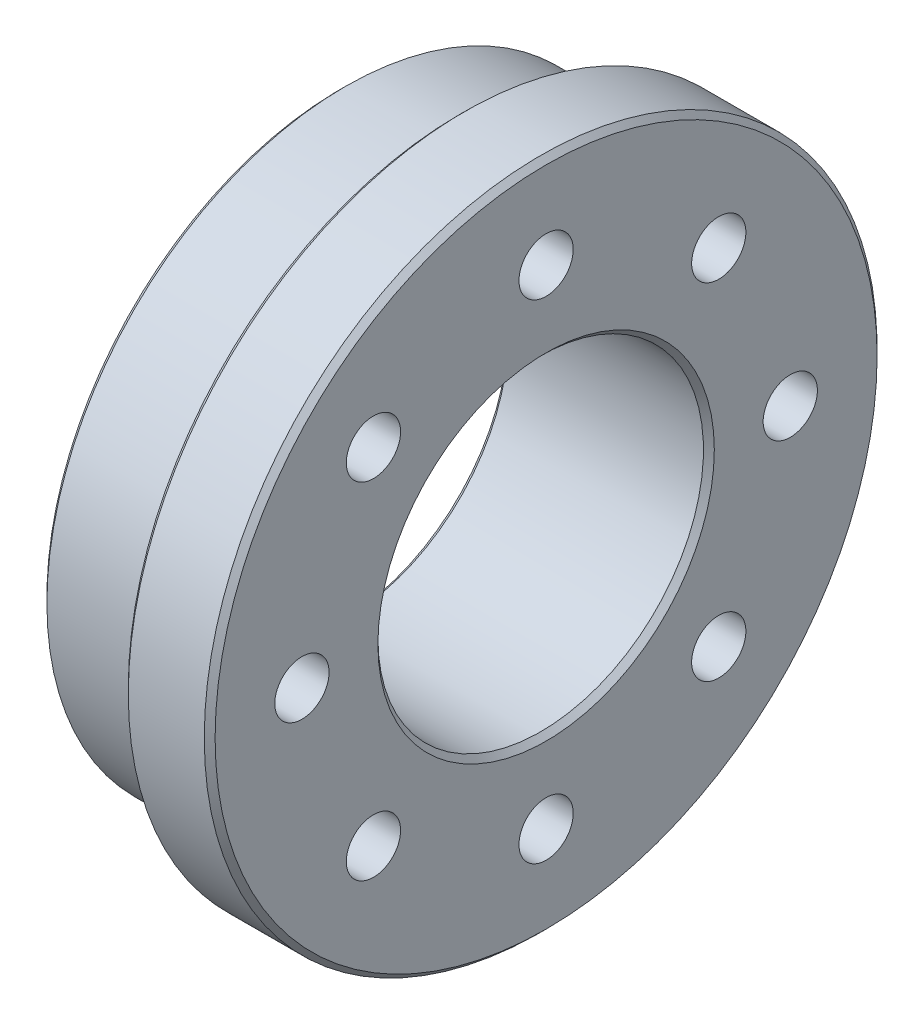
from build123d import *

# Parameters (mm, degrees)
SKETCH_2_R          = 2.5
CUT_EXTRUDE_1_DEPTH = 15
CHAMFER_1_SIZE      = 0.5


with BuildPart() as part:
    # 草图1 → 旋转1 (revolve)
    with BuildSketch(Plane.XY, mode=Mode.PRIVATE) as revolve_1_sk:
        Polygon((0, 15), (19, 15), (19, 31), (11, 31), (11, 27.5), (0, 27.5), align=None)
    revolve(revolve_1_sk.sketch.rotate(Axis((0, 0, 0), (1, 0, 0)), 90), axis=Axis((0, 0, 0), (1, 0, 0)))

    # 草图2 → 切除-拉伸1 (cut)
    with BuildSketch(Plane(origin=(19, 0, 0), x_dir=(0, 0, -1), z_dir=(1, 0, 0))):
        with Locations((0, 22.5)):
            Circle(SKETCH_2_R)
        with Locations((15.909902577, 15.909902577)):
            Circle(SKETCH_2_R)
        with Locations((22.5, 0)):
            Circle(SKETCH_2_R)
        with Locations((15.909902577, -15.909902577)):
            Circle(SKETCH_2_R)
        with Locations((0, -22.5)):
            Circle(SKETCH_2_R)
        with Locations((-15.909902577, -15.909902577)):
            Circle(SKETCH_2_R)
        with Locations((-22.5, 0)):
            Circle(SKETCH_2_R)
        with Locations((-15.909902577, 15.909902577)):
            Circle(SKETCH_2_R)
    extrude(amount=-CUT_EXTRUDE_1_DEPTH, mode=Mode.SUBTRACT)

    # 倒角1
    chamfer_1_edges = [part.edges().sort_by_distance(p)[0] for p in [
        (0, 0, -27.5),
        (11, 0, -31),
        (19, 0, -31),
        (19, 0, -15),
        (0, 0, -15),
    ]]
    chamfer(chamfer_1_edges, length=CHAMFER_1_SIZE)


solid = part.part
